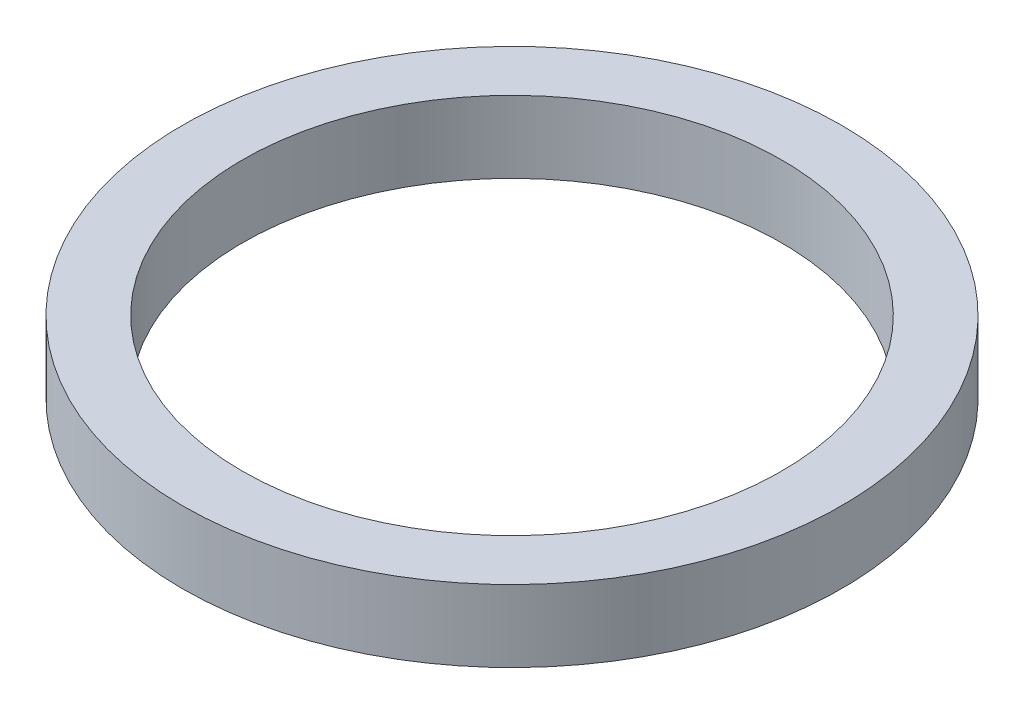
from build123d import *

# Parameters (mm, degrees)
SKETCH1_R           = 27.5
SKETCH1_R_2         = 22.5
BOSS_EXTRUDE1_DEPTH = 3


with BuildPart() as part:
    # Sketch1 → Boss-Extrude1 (new, symmetric)
    with BuildSketch(Plane(origin=(0, 0, 0), x_dir=(1, 0, 0), z_dir=(0, 1, 0))):
        with Locations(Location((0, 0, 0), (0, 0, 270))):
            Circle(SKETCH1_R)
        with Locations(Location((0, 0, 0), (0, 0, 270))):
            Circle(SKETCH1_R_2, mode=Mode.SUBTRACT)
    extrude(amount=BOSS_EXTRUDE1_DEPTH, both=True)


solid = part.part
